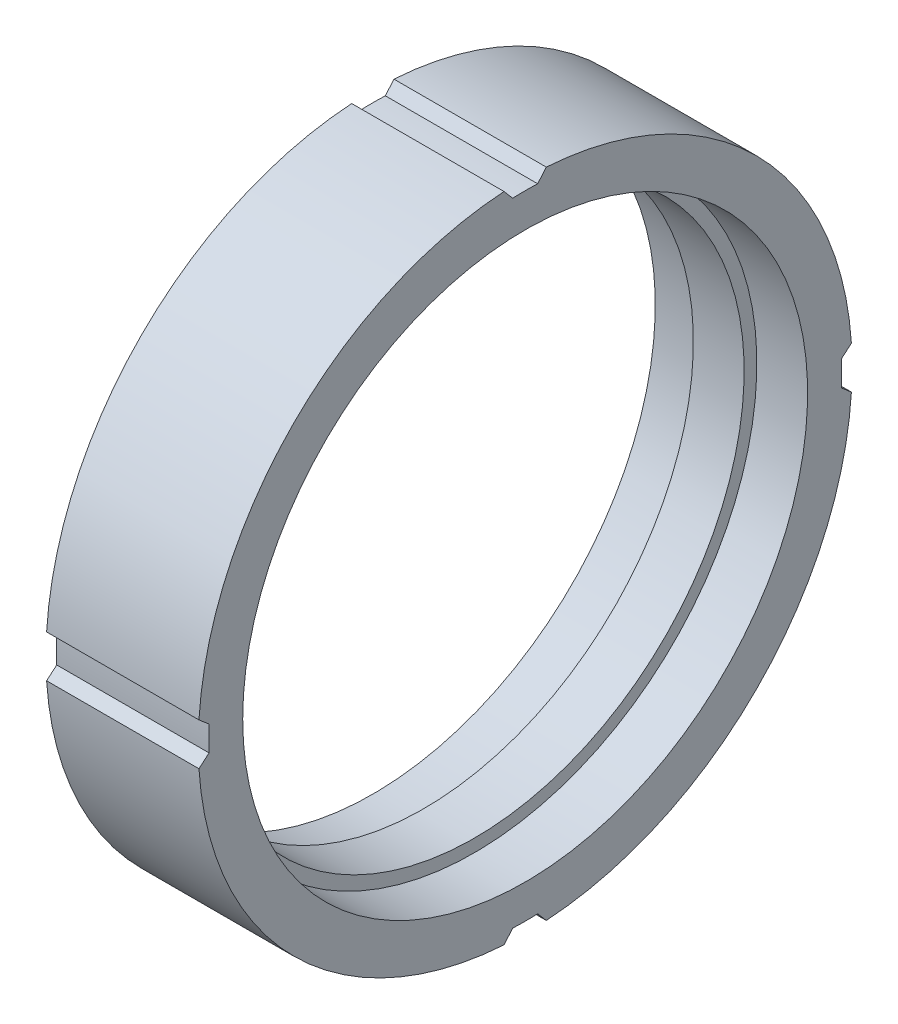
from build123d import *

# Parameters (mm, degrees)
EXTRUS_O4_DEPTH       = 8.668441823
PADR_OCIRCULAR2_COUNT = 4


with BuildPart() as part:
    # Esboço4 → Revolução1 (revolve)
    with BuildSketch(Plane.YX, mode=Mode.PRIVATE) as revolu_o1_sk:
        Polygon((-5.15, -0.116989073), (-5.15, 2.283010927), (-4.45, 2.283010927), (-4.45, 1.483010927), (-4.25, 1.483010927), (-4.25, 0.683010927), (-4.45, 0.683010927), (-4.45, -0.116989073), align=None)
    revolve(revolu_o1_sk.sketch.rotate(Axis((-0.622453524, 0, 0), (1, 0, 0)), 270), axis=Axis((-0.622453524, 0, 0), (1, 0, 0)))

    # Esboço5 → Extrusão4 (cut, through all)
    with BuildSketch(Plane(origin=(2.283010927, 0, 0), x_dir=(0, 0, 1), z_dir=(1, 0, 0))):
        with BuildLine():
            Line((-0.196837681, 4.979857893), (-0.332878645, 5.139230663))
            ThreePointArc((-0.332878645, 5.139230663), (0, 5.15), (0.332878645, 5.139230663))
            Line((0.332878645, 5.139230663), (0.196837681, 4.979857893))
            ThreePointArc((0.196837681, 4.979857893), (0, 4.983746554), (-0.196837681, 4.979857893))
        make_face()
    extrus_o4 = extrude(amount=-EXTRUS_O4_DEPTH, mode=Mode.SUBTRACT)

    # PadrãoCircular2: Extrusão4 ×4 about axis
    padr_ocircular2_axis = Axis((0, 0, 0), (1, 0, 0))
    for i in range(1, PADR_OCIRCULAR2_COUNT):
        add(extrus_o4.rotate(padr_ocircular2_axis, i * 360 / PADR_OCIRCULAR2_COUNT), mode=Mode.SUBTRACT)


solid = part.part
